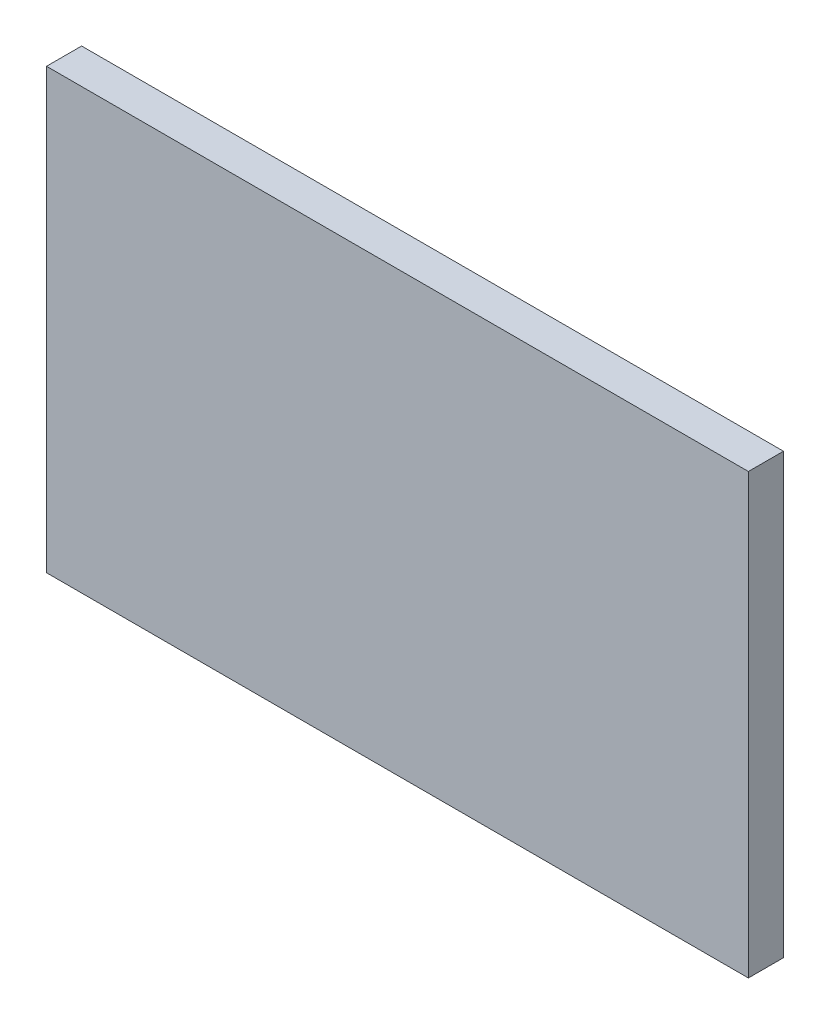
from build123d import *

# Parameters (mm, degrees)
SKETCH1_W           = 1000
SKETCH1_H           = 625
BOSS_EXTRUDE1_DEPTH = 50


with BuildPart() as part:
    # Sketch1 → Boss-Extrude1 (new body)
    with BuildSketch(Plane.XY):
        Rectangle(SKETCH1_W, SKETCH1_H)
    extrude(amount=BOSS_EXTRUDE1_DEPTH)


solid = part.part
